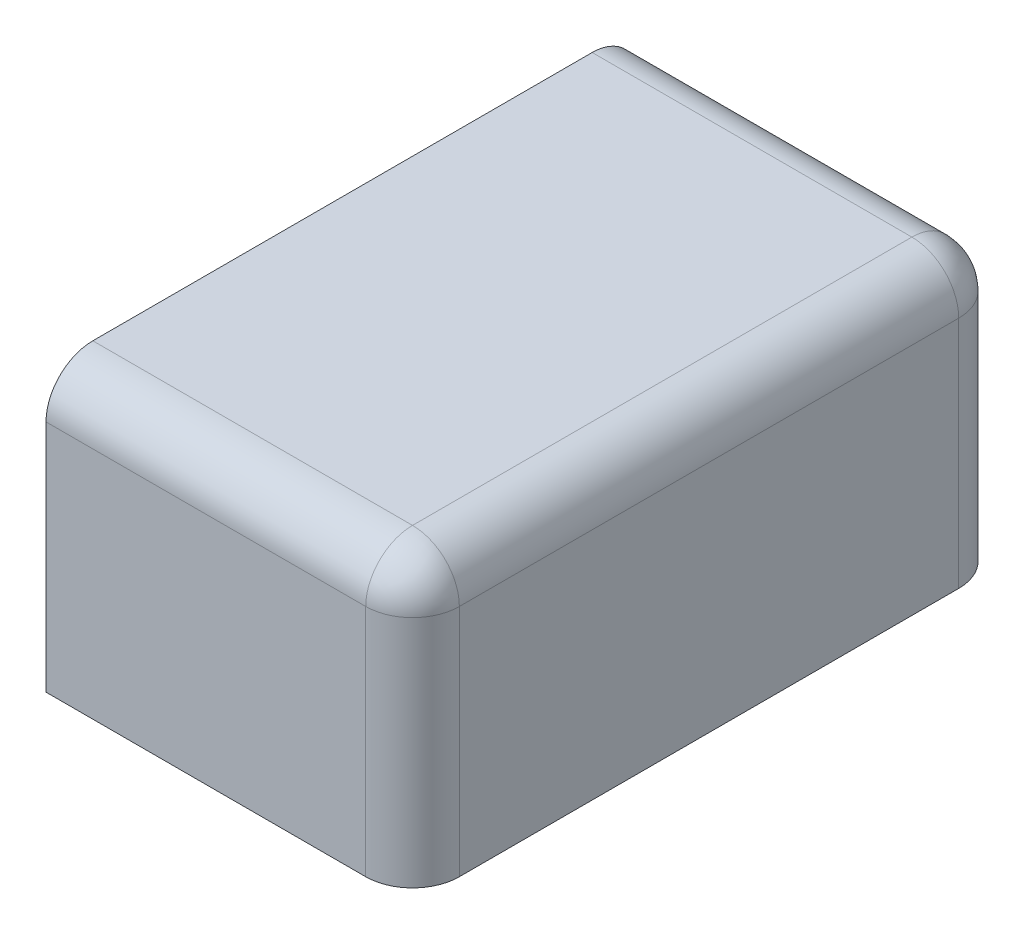
from build123d import *

# Parameters (mm, degrees)
SKETCH1_W           = 37.2872
SKETCH1_H           = 60.325
BOSS_EXTRUDE1_DEPTH = 28.575
FILLET1_R           = 4.7625
SHELL1_T            = -1.5875


with BuildPart() as part:
    # Sketch1 → Boss-Extrude1 (new body)
    with BuildSketch(Plane(origin=(0, 0, 0), x_dir=(1, 0, 0), z_dir=(0, 1, 0))):
        Rectangle(SKETCH1_W, SKETCH1_H)
    extrude(amount=BOSS_EXTRUDE1_DEPTH)

    # Fillet1
    fillet1_edges = [part.edges().sort_by_distance(p)[0] for p in [
        (0, 28.575, -30.1625),
        (18.6436, 28.575, 0),
        (0, 28.575, 30.1625),
        (18.6436, 14.2875, -30.1625),
        (18.6436, 14.2875, 30.1625),
    ]]
    fillet(fillet1_edges, radius=FILLET1_R)

    # Shell1
    shell1_openings = [part.faces().sort_by_distance(p)[0] for p in [
        (-18.6436, 14.212396054, 0),
        (-0.076414213, 0, 0),
    ]]
    offset(amount=SHELL1_T, openings=shell1_openings, kind=Kind.INTERSECTION)


solid = part.part
